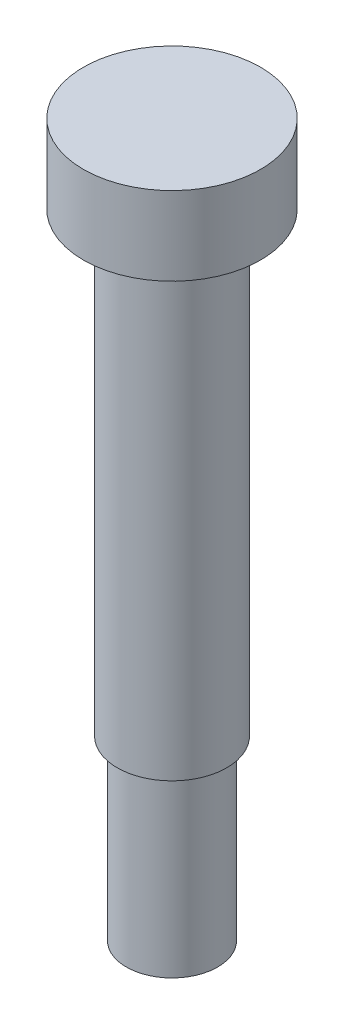
from build123d import *

# Parameters (mm, degrees)
SKETCH_1_R      = 4.85
EXTRUDE_1_DEPTH = 4.3
SKETCH_2_R      = 3
EXTRUDE_2_DEPTH = 25
SKETCH_3_R      = 2.5
EXTRUDE_3_DEPTH = 9.7


with BuildPart() as part:
    # 草图1 → 凸台-拉伸1 (new body)
    with BuildSketch(Plane(origin=(0, 0, 0), x_dir=(1, 0, 0), z_dir=(0, 1, 0))):
        with Locations(Location((0, 0, 0), (0, 0, 90))):
            Circle(SKETCH_1_R)
    extrude(amount=EXTRUDE_1_DEPTH)

    # 草图2 → 凸台-拉伸2 (add)
    with BuildSketch(Plane.XZ):
        with Locations(Location((0, 0, 0), (0, 0, 270))):
            Circle(SKETCH_2_R)
    extrude(amount=EXTRUDE_2_DEPTH)

    # 草图3 → 凸台-拉伸3 (add)
    with BuildSketch(Plane.XZ.offset(25)):
        with Locations(Location((0, 0, 0), (0, 0, 270))):
            Circle(SKETCH_3_R)
    extrude(amount=EXTRUDE_3_DEPTH)


solid = part.part
